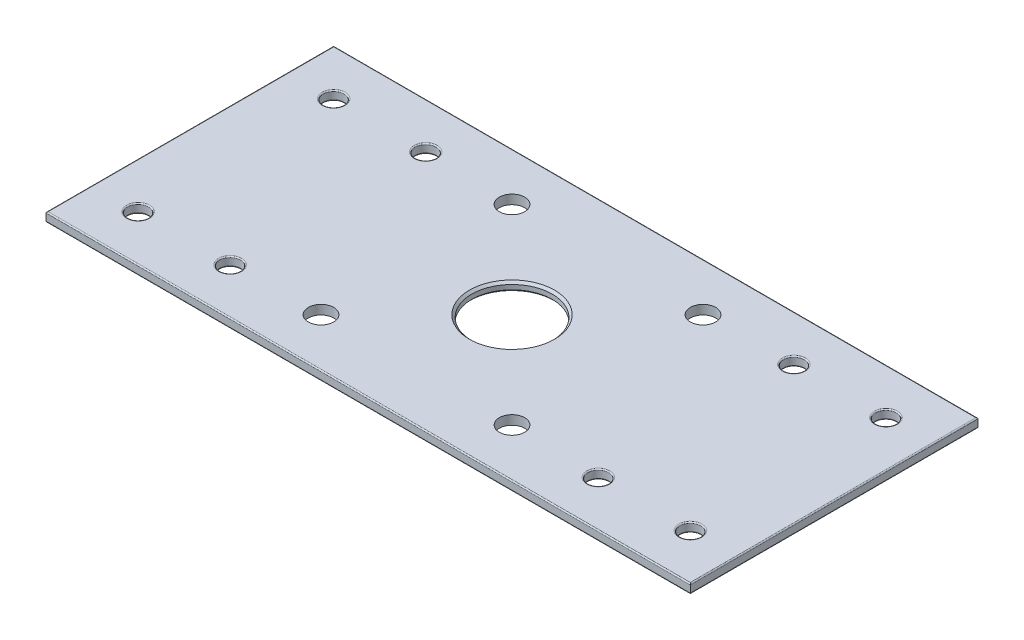
from build123d import *

# Parameters (mm, degrees)
SZKIC1_W                    = 280
SZKIC1_H                    = 125
DODANIE_WYCI_GNI_CIE1_DEPTH = 4
OTW_R_POD_RUB_M81_D         = 9
OTW_R_POD_RUB_M81_DEPTH     = 10
OTW_R_POD_RUB_M81_TIP       = 2.703872786
ZAOKR_GLENIE1_R             = 0.5
OTW_R_POD_RUB_M101_D        = 11
OTW_R_POD_RUB_M101_DEPTH    = 10
OTW_R_POD_RUB_M101_TIP      = 3.304733405
SZKIC5_R                    = 17.5
WYTNIJ_WYCI_GNI_CIE1_DEPTH  = 4
SFAZOWANIE1_SIZE            = 1


with BuildPart() as part:
    # Szkic1 → Dodanie-wyciągnięcie1 (new body)
    with BuildSketch(Plane(origin=(0, 0, 0), x_dir=(1, 0, 0), z_dir=(0, 1, 0))):
        Rectangle(SZKIC1_W, SZKIC1_H)
    extrude(amount=DODANIE_WYCI_GNI_CIE1_DEPTH)

    # Otwór pod śrubę M81
    with Locations(Plane(origin=(0, 4, 0), x_dir=(1, 0, 0), z_dir=(0, 1, 0))):
        with Locations((-120, 42.5), (-80, 42.5), (-80, -42.5), (-120, -42.5), (120, -42.5), (80, -42.5), (80, 42.5), (120, 42.5)):
            Hole(OTW_R_POD_RUB_M81_D / 2, depth=OTW_R_POD_RUB_M81_DEPTH)
            with Locations((0, 0, -(OTW_R_POD_RUB_M81_DEPTH + OTW_R_POD_RUB_M81_TIP / 2))):  # 118° drill point
                Cone(0, OTW_R_POD_RUB_M81_D / 2, OTW_R_POD_RUB_M81_TIP, mode=Mode.SUBTRACT)

    # Zaokrąglenie1
    zaokr_glenie1_edges = [part.edges().sort_by_distance(p)[0] for p in [
        (-140, 4, 0),
        (0, 4, 62.5),
        (124.5, 0, -42.5),
        (124.5, 4, -42.5),
        (84.5, 0, -42.5),
        (84.5, 4, -42.5),
        (84.5, 0, 42.5),
        (84.5, 4, 42.5),
        (124.5, 0, 42.5),
        (124.5, 4, 42.5),
        (-115.5, 0, 42.5),
        (-115.5, 4, 42.5),
        (140, 4, 0),
        (0, 0, 62.5),
        (-75.5, 0, 42.5),
        (-75.5, 4, 42.5),
        (-140, 0, 0),
        (-75.5, 0, -42.5),
        (-75.5, 4, -42.5),
        (0, 0, -62.5),
        (140, 0, 0),
        (-115.5, 0, -42.5),
        (-115.5, 4, -42.5),
        (0, 4, -62.5),
    ]]
    fillet(zaokr_glenie1_edges, radius=ZAOKR_GLENIE1_R)

    # Otwór pod śrubę M101
    with Locations(Plane(origin=(0, 4, 0), x_dir=(1, 0, 0), z_dir=(0, 1, 0))):
        with Locations((41.5, 41.5), (-41.5, 41.5), (-41.5, -41.5), (41.5, -41.5)):
            Hole(OTW_R_POD_RUB_M101_D / 2, depth=OTW_R_POD_RUB_M101_DEPTH)
            with Locations((0, 0, -(OTW_R_POD_RUB_M101_DEPTH + OTW_R_POD_RUB_M101_TIP / 2))):  # 118° drill point
                Cone(0, OTW_R_POD_RUB_M101_D / 2, OTW_R_POD_RUB_M101_TIP, mode=Mode.SUBTRACT)

    # Szkic5 → Wytnij-wyciągnięcie1 (cut)
    with BuildSketch(Plane(origin=(0, 4, 0), x_dir=(1, 0, 0), z_dir=(0, 1, 0))):
        with Locations(Location((0, 0, 0), (0, 0, 270))):
            Circle(SZKIC5_R)
    extrude(amount=-WYTNIJ_WYCI_GNI_CIE1_DEPTH, mode=Mode.SUBTRACT)

    # Sfazowanie1
    sfazowanie1_edges = [part.edges().sort_by_distance(p)[0] for p in [
        (0, 0, -17.5),
        (0, 4, -17.5),
    ]]
    chamfer(sfazowanie1_edges, length=SFAZOWANIE1_SIZE)


solid = part.part
